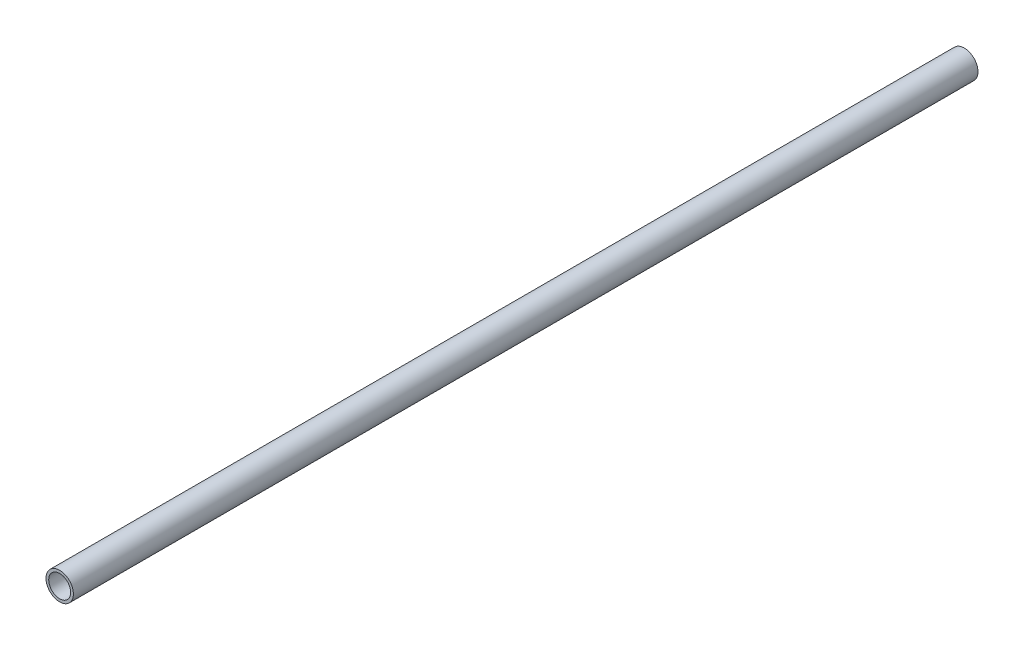
from build123d import *

# Parameters (mm, degrees)
SKIZZE1_R                       = 5
SKIZZE1_R_2                     = 4
AUFSATZ_LINEAR_AUSTRAGEN1_DEPTH = 330


with BuildPart() as part:
    # Skizze1 → Aufsatz-Linear austragen1 (new body)
    with BuildSketch(Plane.XY):
        Circle(SKIZZE1_R)
        Circle(SKIZZE1_R_2, mode=Mode.SUBTRACT)
    extrude(amount=AUFSATZ_LINEAR_AUSTRAGEN1_DEPTH)


solid = part.part
